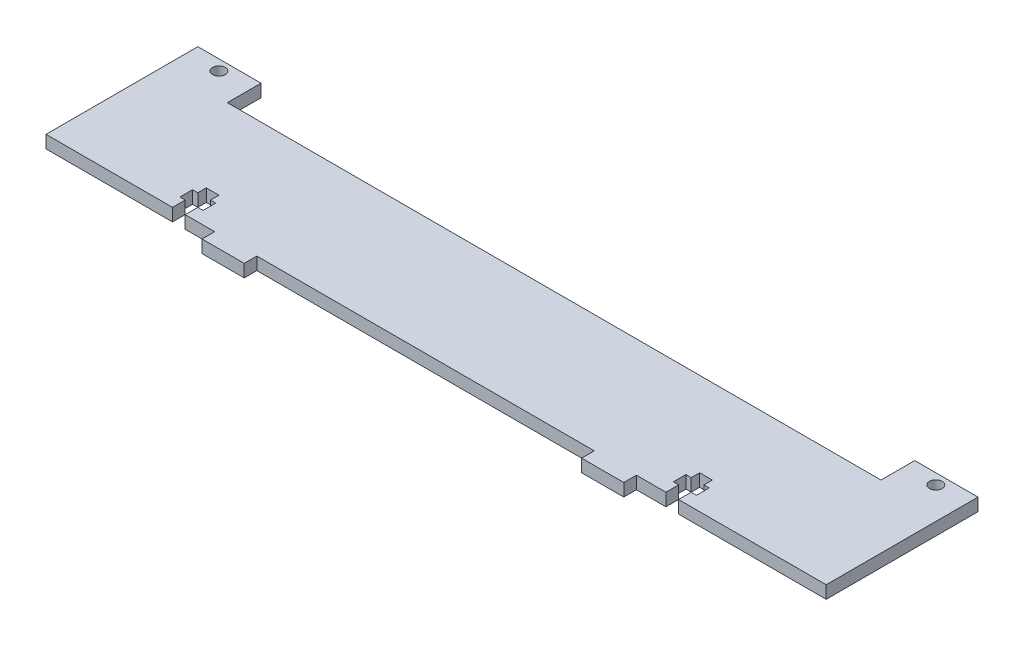
from build123d import *

# Parameters (mm, degrees)
SKETCH1_W           = 220
SKETCH1_H           = 39
BOSS_EXTRUDE1_DEPTH = 3
SKETCH2_W           = 155
SKETCH2_H           = 8
SKETCH2_W_2         = 80
SKETCH2_H_2         = 3
SKETCH2_R           = 1.5
CUT_EXTRUDE2_DEPTH  = 3


with BuildPart() as part:
    # Sketch1 → Boss-Extrude1 (new body)
    with BuildSketch(Plane(origin=(0, 0, 0), x_dir=(1, 0, 0), z_dir=(0, 1, 0))):
        Rectangle(SKETCH1_W, SKETCH1_H)
    extrude(amount=BOSS_EXTRUDE1_DEPTH)

    # Sketch2 → Cut-Extrude2 (cut)
    with BuildSketch(Plane.XZ):
        Polygon((-77, 16.5), (-80, 16.5), (-80, 13.5), (-81.25, 13.5), (-81.25, 10.5), (-80, 10.5), (-80, 8.5), (-77, 8.5), (-77, 10.5), (-75.75, 10.5), (-75.75, 13.5), (-77, 13.5), align=None)
        Polygon((-110, 16.5), (-80, 16.5), (-77, 16.5), (-70, 16.5), (-70, 19.5), (-110, 19.5), align=None)
        with Locations((-17.5, -15.5)):
            Rectangle(SKETCH2_W, SKETCH2_H)
        Polygon((110, 19.5), (75, 19.5), (75, 16.5), (75, -13), (75, -19.5), (110, -19.5), align=None)
        Polygon((75, 16.5), (75, 19.5), (30, 19.5), (30, 16.5), (37, 16.5), (40, 16.5), align=None)
        Polygon((40, 13.5), (40, 16.5), (37, 16.5), (37, 13.5), (35.75, 13.5), (35.75, 10.5), (37, 10.5), (37, 8.5), (40, 8.5), (40, 10.5), (41.25, 10.5), (41.25, 13.5), align=None)
        with Locations((-20, 18)):
            Rectangle(SKETCH2_W_2, SKETCH2_H_2)
        with Locations(Location((-102.5, -17, 0), (0, 0, 270))):
            Circle(SKETCH2_R)
        with Locations(Location((67.5, -17, 0), (0, 0, 270))):
            Circle(SKETCH2_R)
    extrude(amount=-CUT_EXTRUDE2_DEPTH, mode=Mode.SUBTRACT)


solid = part.part
